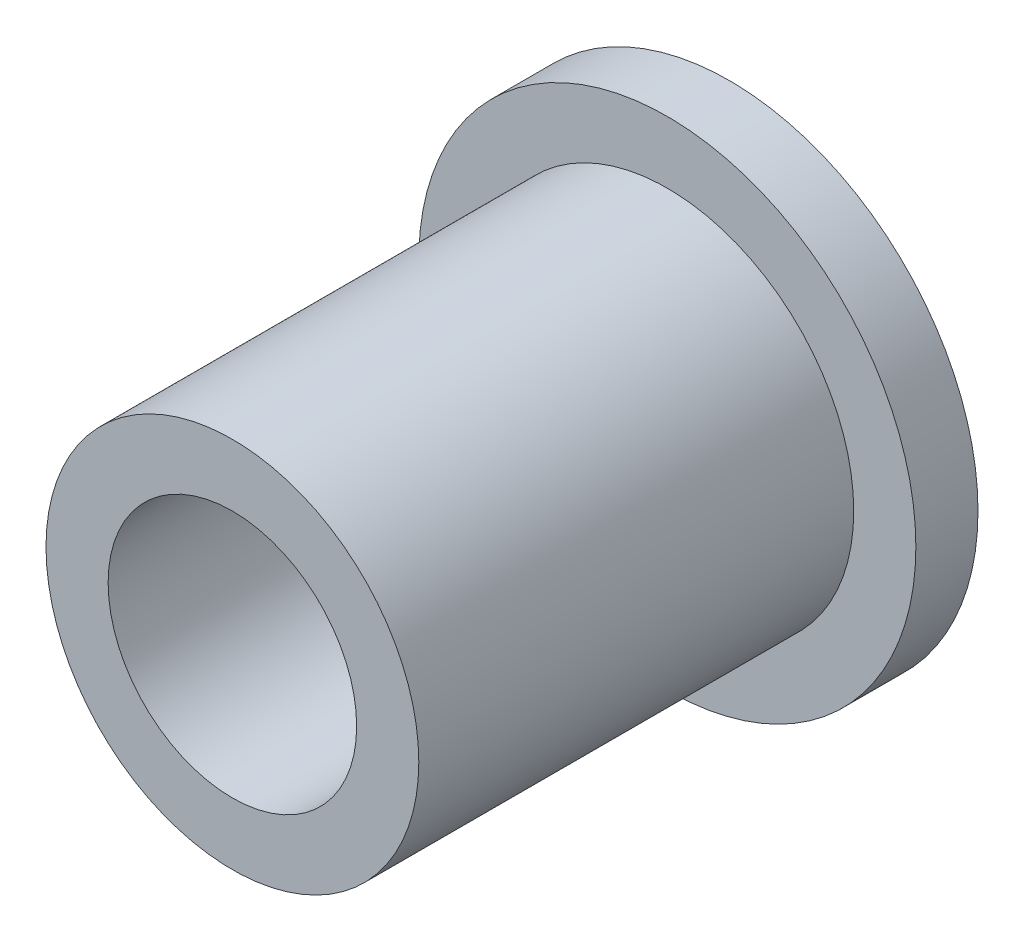
from build123d import *


with BuildPart() as part:
    # Sketch1 → Revolve1 (revolve)
    with BuildSketch(Plane(origin=(0, 0, 0), x_dir=(0, 0, -1), z_dir=(1, 0, 0)), mode=Mode.PRIVATE) as revolve1_sk:
        Polygon((0, 3.175), (0, 4.7625), (11.1125, 4.7625), (11.1125, 6.35), (12.7, 6.35), (12.7, 3.175), align=None)
    revolve(revolve1_sk.sketch.rotate(Axis((0, 0, 0), (0, 0, -1)), 90), axis=Axis((0, 0, 0), (0, 0, -1)))


solid = part.part
